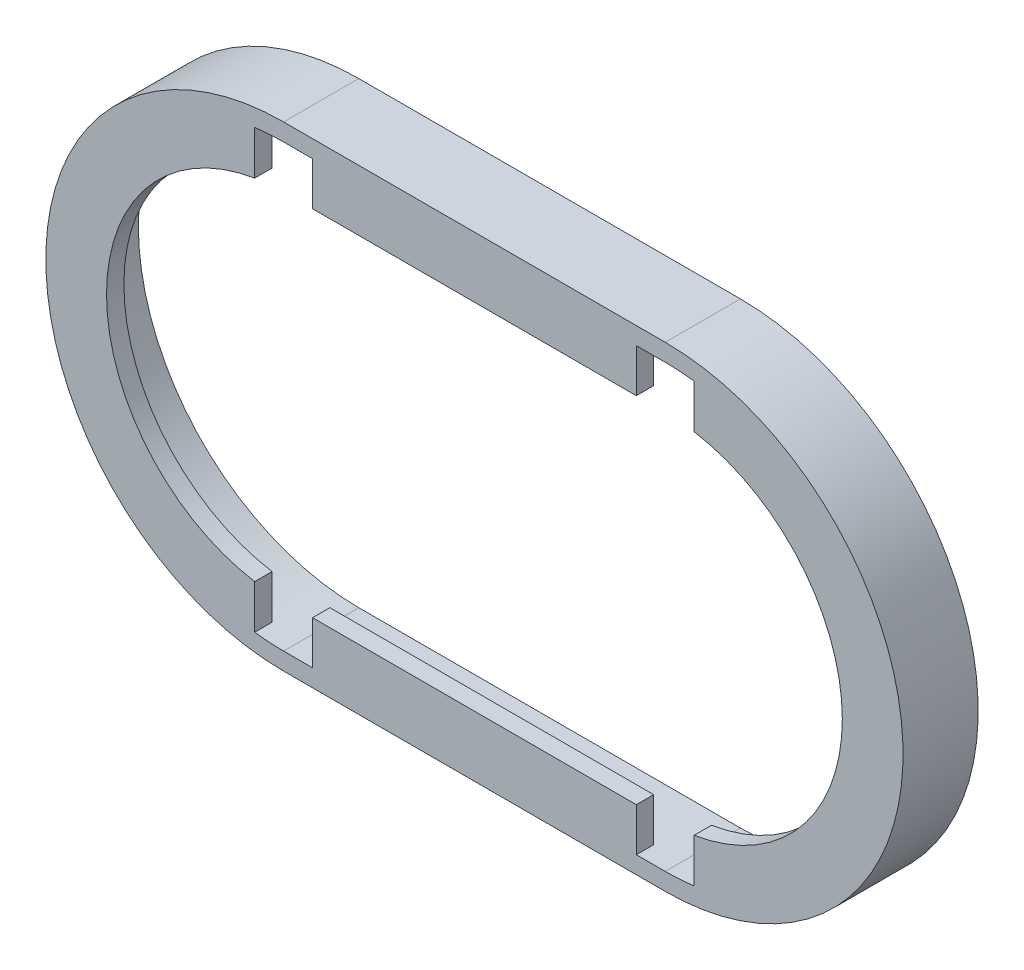
from build123d import *

# Parameters (mm, degrees)
BOSS_EXTRUDE1_DEPTH      = 1.2
BOSS_EXTRUDE1_DEPTH_BACK = 4
SKETCH3_W                = 22.4
SKETCH3_H                = 1.5
BOSS_EXTRUDE2_DEPTH      = 1.2


with BuildPart() as part:
    # Sketch1 → Boss-Extrude1 (new, two sides: drawn at the far end of the back side and taken through both)
    with BuildSketch(Plane.XY.offset(-BOSS_EXTRUDE1_DEPTH_BACK)):
        with BuildLine():
            Line((-34.384444189, 19.919216619), (-7.984444189, 19.919216619))
            ThreePointArc((-7.984444189, 19.919216619), (8.465555811, 3.469216619), (-7.984444189, -12.980783381))
            Line((-7.984444189, -12.980783381), (-34.384444189, -12.980783381))
            ThreePointArc((-34.384444189, -12.980783381), (-50.834444189, 3.469216619), (-34.384444189, 19.919216619))
        make_face()
        with BuildLine():
            Line((-34.384444189, 18.719216619), (-7.984444189, 18.719216619))
            ThreePointArc((-7.984444189, 18.719216619), (7.265555811, 3.469216619), (-7.984444189, -11.780783381))
            Line((-7.984444189, -11.780783381), (-34.384444189, -11.780783381))
            ThreePointArc((-34.384444189, -11.780783381), (-49.634444189, 3.469216619), (-34.384444189, 18.719216619))
        make_face(mode=Mode.SUBTRACT)
    extrude(amount=BOSS_EXTRUDE1_DEPTH + BOSS_EXTRUDE1_DEPTH_BACK)

    # Sketch3 → Boss-Extrude2 (add)
    with BuildSketch(Plane.XY):
        with BuildLine():
            Line((-36.384444189, 17.07298448), (-36.384444189, 18.587500252))
            ThreePointArc((-36.384444189, 18.587500252), (-49.634444189, 3.469216619), (-36.384444189, -11.649067014))
            Line((-36.384444189, -11.649067014), (-36.384444189, -10.134551241))
            ThreePointArc((-36.384444189, -10.134551241), (-48.134444189, 3.469216619), (-36.384444189, 17.07298448))
        make_face()
        with BuildLine():
            Line((-36.384444189, 15.554848584), (-36.384444189, 17.07298448))
            ThreePointArc((-36.384444189, 17.07298448), (-48.134444189, 3.469216619), (-36.384444189, -10.134551241))
            Line((-36.384444189, -10.134551241), (-36.384444189, -8.616415346))
            ThreePointArc((-36.384444189, -8.616415346), (-46.634444189, 3.469216619), (-36.384444189, 15.554848584))
        make_face()
        with Locations((-21.184444189, 17.969216619)):
            Rectangle(SKETCH3_W, SKETCH3_H)
        with Locations((-21.184444189, 16.469216619)):
            Rectangle(SKETCH3_W, SKETCH3_H)
        with BuildLine():
            ThreePointArc((4.998717984, 11.469216619), (0.309606549, 16.266529711), (-5.984444189, 18.587500252))
            Line((-5.984444189, 18.587500252), (-5.984444189, 17.07298448))
            ThreePointArc((-5.984444189, 17.07298448), (-0.822090303, 15.206472977), (3.198690434, 11.469216619))
            Line((3.198690434, 11.469216619), (4.998717984, 11.469216619))
        make_face()
        with BuildLine():
            ThreePointArc((3.198690434, 11.469216619), (-0.822090303, 15.206472977), (-5.984444189, 17.07298448))
            Line((-5.984444189, 17.07298448), (-5.984444189, 15.554848584))
            ThreePointArc((-5.984444189, 15.554848584), (4.265555811, 3.469216619), (-5.984444189, -8.616415346))
            Line((-5.984444189, -8.616415346), (-5.984444189, -10.134551241))
            ThreePointArc((-5.984444189, -10.134551241), (-0.822090303, -8.268039739), (3.198690434, -4.530783381))
            Line((3.198690434, -4.530783381), (4.998717984, -4.530783381))
            ThreePointArc((4.998717984, -4.530783381), (7.265555811, 3.469216619), (4.998717984, 11.469216619))
            Line((4.998717984, 11.469216619), (3.198690434, 11.469216619))
        make_face()
        with BuildLine():
            ThreePointArc((-5.984444189, -11.649067014), (0.309606549, -9.328096472), (4.998717984, -4.530783381))
            Line((4.998717984, -4.530783381), (3.198690434, -4.530783381))
            ThreePointArc((3.198690434, -4.530783381), (-0.822090303, -8.268039739), (-5.984444189, -10.134551241))
            Line((-5.984444189, -10.134551241), (-5.984444189, -11.649067014))
        make_face()
        with Locations((-21.184444189, -9.530783381)):
            Rectangle(SKETCH3_W, SKETCH3_H)
        with Locations((-21.184444189, -11.030783381)):
            Rectangle(SKETCH3_W, SKETCH3_H)
    extrude(amount=BOSS_EXTRUDE2_DEPTH)


solid = part.part
